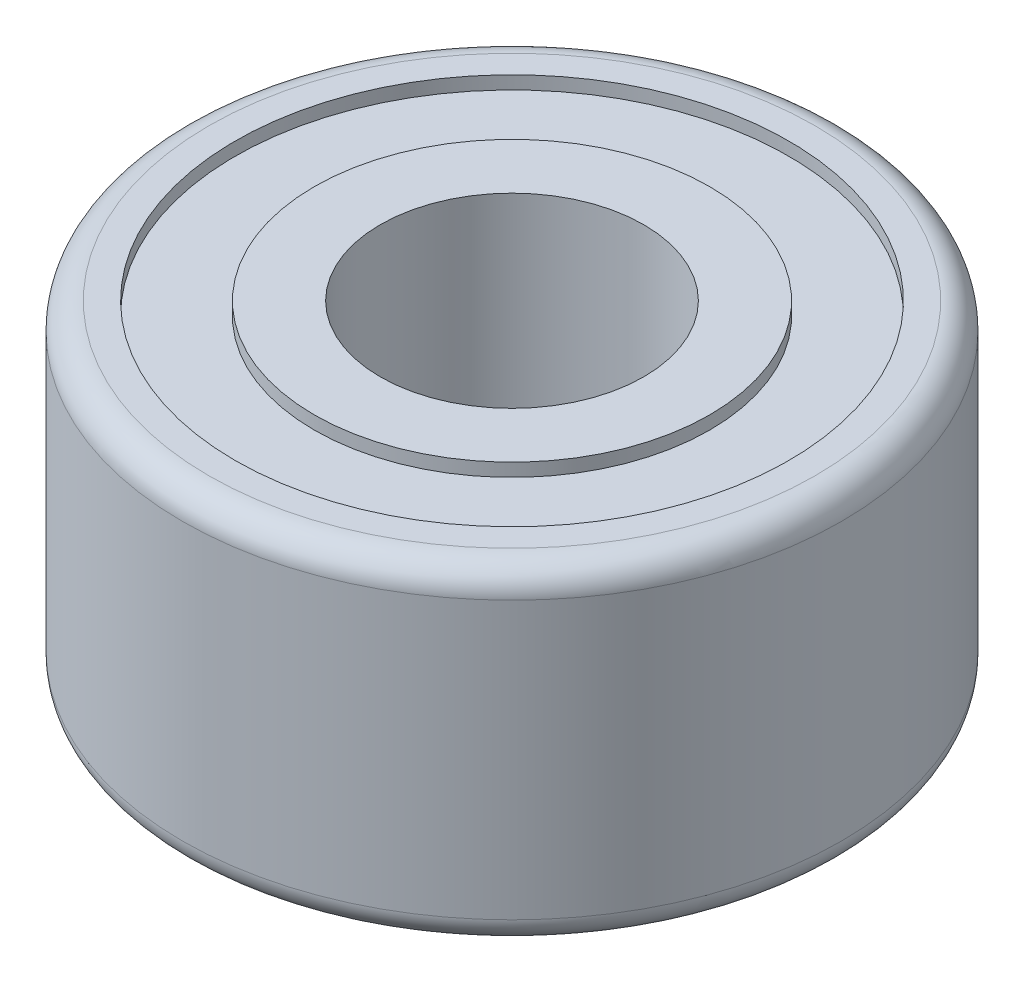
from build123d import *

# Parameters (mm, degrees)
SKETCH1_R           = 2.5
SKETCH1_R_2         = 1
BOSS_EXTRUDE1_DEPTH = 2.5
FILLET1_R           = 0.2
SKETCH2_R           = 2.1
SKETCH2_R_2         = 1.5
CUT_EXTRUDE1_DEPTH  = 0.1
CUT_EXTRUDE2_START  = -0.1
SKETCH3_R           = 2.1
SKETCH3_R_2         = 1.5
CUT_EXTRUDE2_DEPTH  = 0.1


with BuildPart() as part:
    # Sketch1 → Boss-Extrude1 (new body)
    with BuildSketch(Plane(origin=(0, 0, 0), x_dir=(1, 0, 0), z_dir=(0, 1, 0))):
        with Locations(Location((0, 0, 0), (0, 0, 270))):
            Circle(SKETCH1_R)
        with Locations(Location((0, 0, 0), (0, 0, 270))):
            Circle(SKETCH1_R_2, mode=Mode.SUBTRACT)
    extrude(amount=BOSS_EXTRUDE1_DEPTH)

    # Fillet1
    fillet1_edges = [part.edges().sort_by_distance(p)[0] for p in [
        (0, 0, -2.5),
        (0, 2.5, -2.5),
    ]]
    fillet(fillet1_edges, radius=FILLET1_R)

    # Sketch2 → Cut-Extrude1 (cut)
    with BuildSketch(Plane(origin=(0, 2.5, 0), x_dir=(1, 0, 0), z_dir=(0, 1, 0))):
        with Locations(Location((0, 0, 0), (0, 0, 270))):
            Circle(SKETCH2_R)
        with Locations(Location((0, 0, 0), (0, 0, 270))):
            Circle(SKETCH2_R_2, mode=Mode.SUBTRACT)
    extrude(amount=-CUT_EXTRUDE1_DEPTH, mode=Mode.SUBTRACT)

    # Sketch3 → Cut-Extrude2 (cut)
    with BuildSketch(Plane.XZ.offset(CUT_EXTRUDE2_START)):
        with Locations(Location((0, 0, 0), (0, 0, 90))):
            Circle(SKETCH3_R)
        with Locations(Location((0, 0, 0), (0, 0, 90))):
            Circle(SKETCH3_R_2, mode=Mode.SUBTRACT)
    extrude(amount=CUT_EXTRUDE2_DEPTH, mode=Mode.SUBTRACT)


solid = part.part
